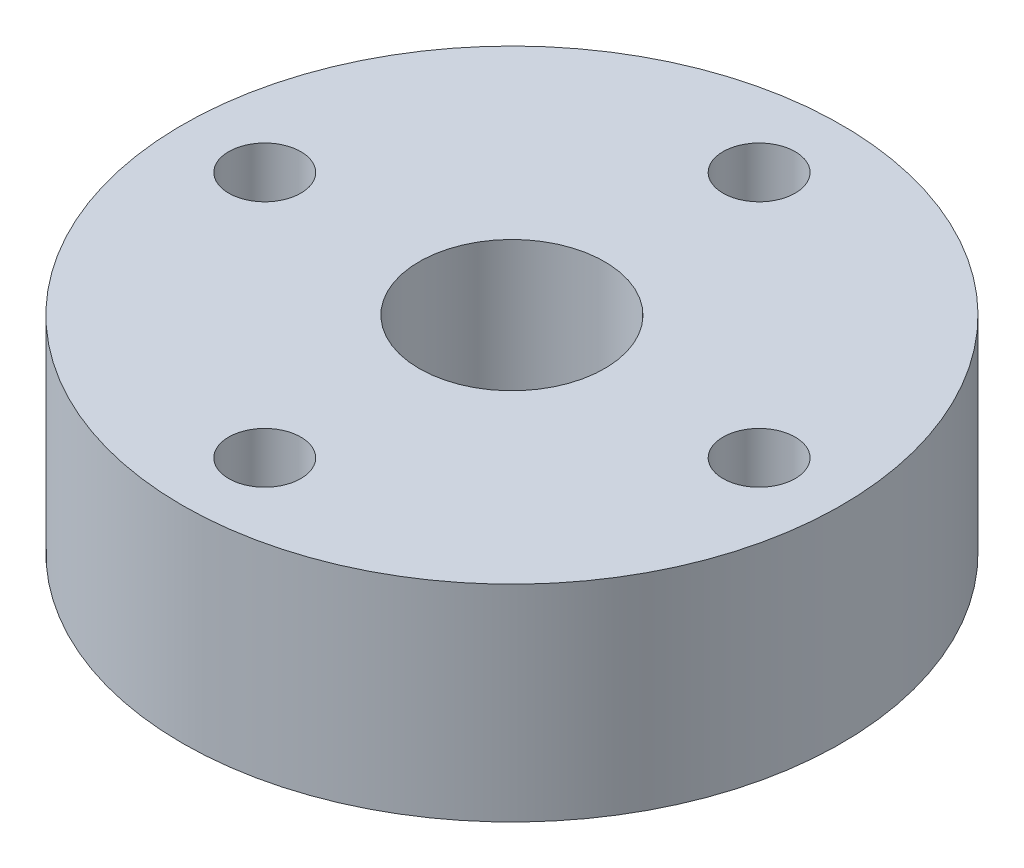
from build123d import *

# Parameters (mm, degrees)
SKETCH2_R           = 16
SKETCH2_R_2         = 4.5
SKETCH2_R_3         = 1.75
BOSS_EXTRUDE1_DEPTH = 10


with BuildPart() as part:
    # Sketch2 → Boss-Extrude1 (new body)
    with BuildSketch(Plane(origin=(0, 0, 0), x_dir=(1, 0, 0), z_dir=(0, 1, 0))):
        with Locations(Location((0, 0, 0), (0, 0, 270))):
            Circle(SKETCH2_R)
        with Locations(Location((0, 0, 0), (0, 0, 270))):
            Circle(SKETCH2_R_2, mode=Mode.SUBTRACT)
        with Locations(Location((0, 12, 0), (0, 0, 270))):
            Circle(SKETCH2_R_3, mode=Mode.SUBTRACT)
        with Locations(Location((-12, 0, 0), (0, 0, 270))):
            Circle(SKETCH2_R_3, mode=Mode.SUBTRACT)
        with Locations(Location((0, -12, 0), (0, 0, 270))):
            Circle(SKETCH2_R_3, mode=Mode.SUBTRACT)
        with Locations(Location((12, 0, 0), (0, 0, 270))):
            Circle(SKETCH2_R_3, mode=Mode.SUBTRACT)
    extrude(amount=BOSS_EXTRUDE1_DEPTH)


solid = part.part
